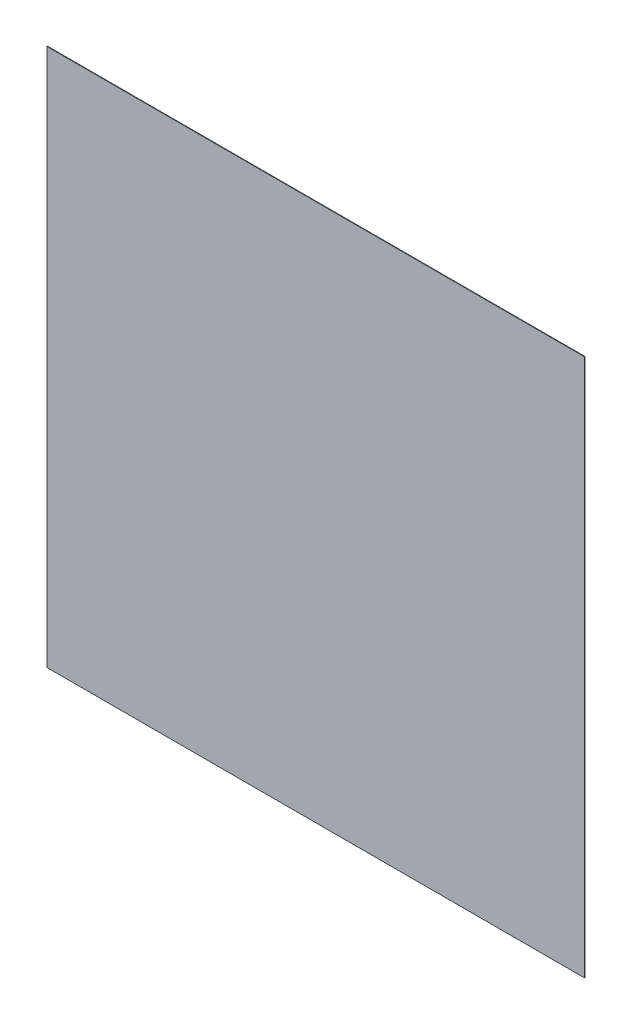
from build123d import *

# Parameters (mm, degrees)
SKETCH_1_W      = 1000
SKETCH_1_H      = 1000
EXTRUDE_1_DEPTH = 1


with BuildPart() as part:
    # 草图1 → 凸台-拉伸1 (new body)
    with BuildSketch(Plane.XY):
        with Locations((500, -500)):
            Rectangle(SKETCH_1_W, SKETCH_1_H)
    extrude(amount=EXTRUDE_1_DEPTH)


solid = part.part
